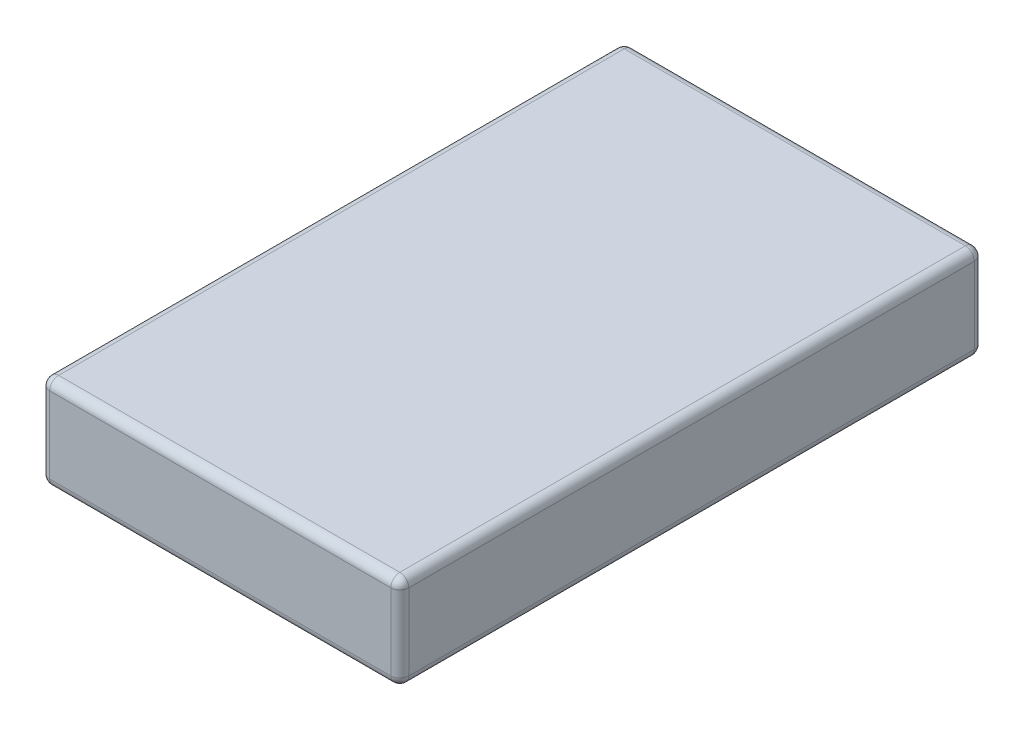
from build123d import *

# Parameters (mm, degrees)
SKETCH1_W           = 2032
SKETCH1_H           = 3302
BOSS_EXTRUDE1_DEPTH = 533.4
FILLET1_R           = 50.8


with BuildPart() as part:
    # Sketch1 → Boss-Extrude1 (new body)
    with BuildSketch(Plane(origin=(0, 0, 0), x_dir=(1, 0, 0), z_dir=(0, 1, 0))):
        Rectangle(SKETCH1_W, SKETCH1_H)
    extrude(amount=BOSS_EXTRUDE1_DEPTH)

    # Fillet1
    fillet1_edges = [part.edges().sort_by_distance(p)[0] for p in [
        (-1016, 533.4, 0),
        (0, 533.4, 1651),
        (1016, 533.4, 0),
        (0, 0, 1651),
        (-1016, 0, 0),
        (0, 0, -1651),
        (1016, 0, 0),
        (1016, 266.7, 1651),
        (-1016, 266.7, 1651),
        (-1016, 266.7, -1651),
        (1016, 266.7, -1651),
        (0, 533.4, -1651),
    ]]
    fillet(fillet1_edges, radius=FILLET1_R)


solid = part.part
